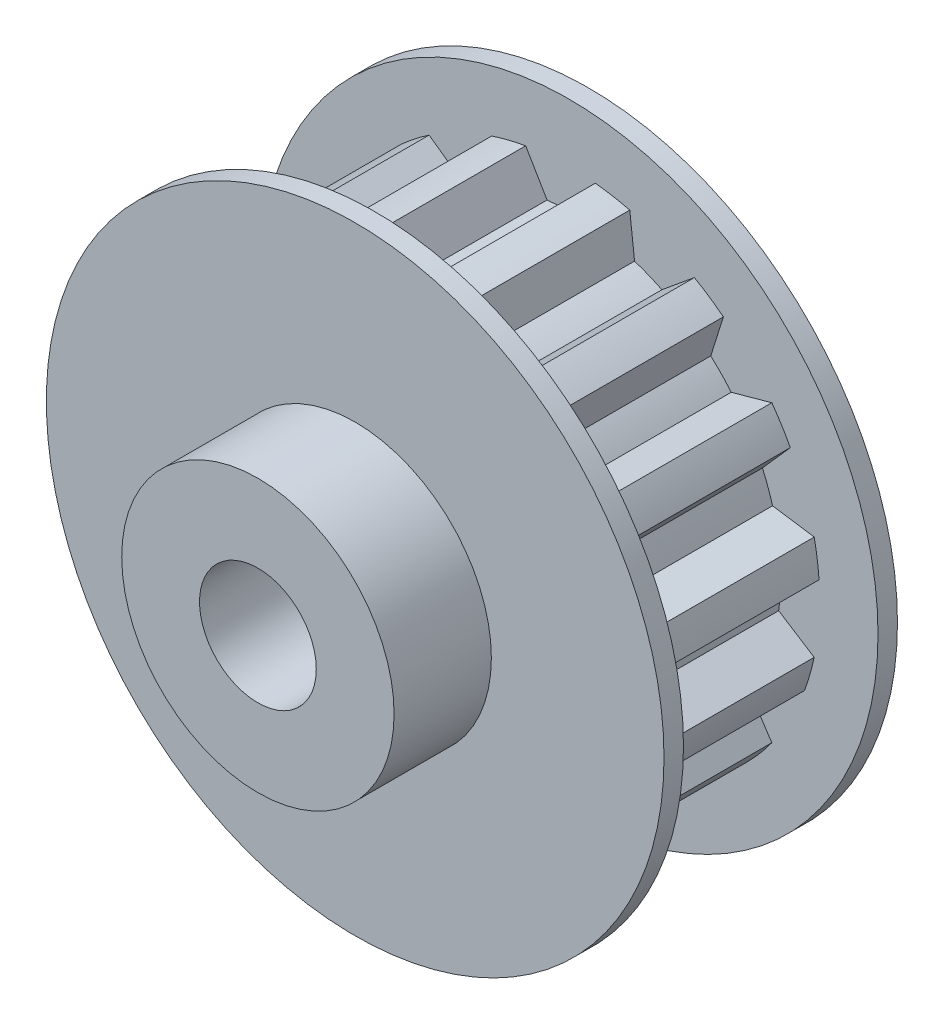
from build123d import *

# Parameters (mm, degrees)
SKETCH1_R           = 15.875
BOSS_EXTRUDE1_DEPTH = 1
BOSS_EXTRUDE2_DEPTH = 10
SKETCH3_R           = 15.875
BOSS_EXTRUDE3_DEPTH = 1
SKETCH4_R           = 7
BOSS_EXTRUDE4_DEPTH = 5
CUT_EXTRUDE1_REACH  = 30.161
SKETCH5_R           = 3


with BuildPart() as part:
    # Sketch1 → Boss-Extrude1 (new body)
    with BuildSketch(Plane.XY):
        Circle(SKETCH1_R)
    extrude(amount=BOSS_EXTRUDE1_DEPTH)

    # Sketch2 → Boss-Extrude2 (add)
    with BuildSketch(Plane.XY.offset(1)):
        with BuildLine():
            Line((9.934806852, -4.423260993), (12.098542493, -4.403509345))
            ThreePointArc((12.098542493, -4.403509345), (12.376244335, -3.548830956), (12.593650359, -2.676863019))
            Line((12.593650359, -2.676863019), (10.769165248, -1.513507473))
            ThreePointArc((10.769165248, -1.513507473), (10.848509047, -0.758601652), (10.875, 0))
            Line((10.875, 0), (12.843637147, 0.898114599))
            ThreePointArc((12.843637147, 0.898114599), (12.749701385, 1.791853675), (12.593650359, 2.676863019))
            Line((12.593650359, 2.676863019), (10.453720943, 2.997556245))
            ThreePointArc((10.453720943, 2.997556245), (10.219157251, 3.719469059), (9.934806852, 4.423260993))
            Line((9.934806852, 4.423260993), (11.367950258, 6.044446371))
            ThreePointArc((11.367950258, 6.044446371), (10.918619238, 6.822710527), (10.416093803, 7.567735123))
            Line((10.416093803, 7.567735123), (8.330733319, 6.990315255))
            ThreePointArc((8.330733319, 6.990315255), (7.822820329, 7.554409779), (7.276795344, 8.081699977))
            Line((7.276795344, 8.081699977), (7.926641495, 10.145638453))
            ThreePointArc((7.926641495, 10.145638453), (7.199608632, 10.673858747), (6.4375, 11.150077074))
            Line((6.4375, 11.150077074), (4.767286221, 9.774385254))
            ThreePointArc((4.767286221, 9.774385254), (4.073846703, 10.083124418), (3.360559814, 10.342739615))
            Line((3.360559814, 10.342739615), (3.114744406, 12.492557476))
            ThreePointArc((3.114744406, 12.492557476), (2.235720287, 12.67939982), (1.345803965, 12.804469403))
            Line((1.345803965, 12.804469403), (0.379532027, 10.868375244))
            ThreePointArc((0.379532027, 10.868375244), (-0.379532027, 10.868375244), (-1.136747038, 10.815425612))
            Line((-1.136747038, 10.815425612), (-2.235720287, 12.67939982))
            ThreePointArc((-2.235720287, 12.67939982), (-3.114744406, 12.492557476), (-3.978593803, 12.244852647))
            Line((-3.978593803, 12.244852647), (-4.073846703, 10.083124418))
            ThreePointArc((-4.073846703, 10.083124418), (-4.767286221, 9.774385254), (-5.4375, 9.418026266))
            Line((-5.4375, 9.418026266), (-7.199608632, 10.673858747))
            ThreePointArc((-7.199608632, 10.673858747), (-7.926641495, 10.145638453), (-8.615056557, 9.567989628))
            Line((-8.615056557, 9.567989628), (-7.822820329, 7.554409779))
            ThreePointArc((-7.822820329, 7.554409779), (-8.330733319, 6.990315255), (-8.798059814, 6.392164619))
            Line((-8.798059814, 6.392164619), (-10.918619238, 6.822710527))
            ThreePointArc((-10.918619238, 6.822710527), (-11.367950258, 6.044446371), (-11.761897767, 5.23673428))
            Line((-11.761897767, 5.23673428), (-10.219157251, 3.719469059))
            ThreePointArc((-10.219157251, 3.719469059), (-10.453720943, 2.997556245), (-10.637355158, 2.261039638))
            Line((-10.637355158, 2.261039638), (-12.749701385, 1.791853675))
            ThreePointArc((-12.749701385, 1.791853675), (-12.843637147, 0.898114599), (-12.875, 0))
            Line((-12.875, 0), (-10.848509047, -0.758601652))
            ThreePointArc((-10.848509047, -0.758601652), (-10.769165248, -1.513507473), (-10.637355158, -2.261039638))
            Line((-10.637355158, -2.261039638), (-12.376244335, -3.548830956))
            ThreePointArc((-12.376244335, -3.548830956), (-12.098542493, -4.403509345), (-11.761897767, -5.23673428))
            Line((-11.761897767, -5.23673428), (-9.602055072, -5.105503245))
            ThreePointArc((-9.602055072, -5.105503245), (-9.222523046, -5.762871999), (-8.798059814, -6.392164619))
            Line((-8.798059814, -6.392164619), (-9.862822205, -8.275890475))
            ThreePointArc((-9.862822205, -8.275890475), (-9.261499929, -8.94372652), (-8.615056557, -9.567989628))
            Line((-8.615056557, -9.567989628), (-6.695318544, -8.569616945))
            ThreePointArc((-6.695318544, -8.569616945), (-6.081222825, -9.015783602), (-5.4375, -9.418026266))
            Line((-5.4375, -9.418026266), (-5.644028515, -11.571973346))
            ThreePointArc((-5.644028515, -11.571973346), (-4.82305989, -11.937492128), (-3.978593803, -12.244852647))
            Line((-3.978593803, -12.244852647), (-2.630900615, -10.551966023))
            ThreePointArc((-2.630900615, -10.551966023), (-1.888423932, -10.709784314), (-1.136747038, -10.815425612))
            Line((-1.136747038, -10.815425612), (-0.44933102, -12.867156898))
            ThreePointArc((-0.44933102, -12.867156898), (0.44933102, -12.867156898), (1.345803965, -12.804469403))
            Line((1.345803965, -12.804469403), (1.888423932, -10.709784314))
            ThreePointArc((1.888423932, -10.709784314), (2.630900615, -10.551966023), (3.360559814, -10.342739615))
            Line((3.360559814, -10.342739615), (4.82305989, -11.937492128))
            ThreePointArc((4.82305989, -11.937492128), (5.644028515, -11.571973346), (6.4375, -11.150077074))
            Line((6.4375, -11.150077074), (6.081222825, -9.015783602))
            ThreePointArc((6.081222825, -9.015783602), (6.695318544, -8.569616945), (7.276795344, -8.081699977))
            Line((7.276795344, -8.081699977), (9.261499929, -8.94372652))
            ThreePointArc((9.261499929, -8.94372652), (9.862822205, -8.275890475), (10.416093803, -7.567735123))
            Line((10.416093803, -7.567735123), (9.222523046, -5.762871999))
            ThreePointArc((9.222523046, -5.762871999), (9.602055072, -5.105503245), (9.934806852, -4.423260993))
        make_face()
    extrude(amount=BOSS_EXTRUDE2_DEPTH)

    # Sketch3 → Boss-Extrude3 (add)
    with BuildSketch(Plane.XY.offset(11)):
        Circle(SKETCH3_R)
    extrude(amount=BOSS_EXTRUDE3_DEPTH)

    # Sketch4 → Boss-Extrude4 (add)
    with BuildSketch(Plane.XY.offset(12)):
        Circle(SKETCH4_R)
    extrude(amount=BOSS_EXTRUDE4_DEPTH)

    # Sketch5 → Cut-Extrude1 (cut, up to next)
    with BuildSketch(Plane.XY.offset(17), mode=Mode.PRIVATE) as cut_extrude1_sk1:
        Circle(SKETCH5_R)
    cut_extrude1_tool1 = extrude(cut_extrude1_sk1.sketch, amount=-CUT_EXTRUDE1_REACH, mode=Mode.PRIVATE) & part.part
    add(cut_extrude1_tool1.solids().sort_by_distance((0, 0, 17))[0], mode=Mode.SUBTRACT)


solid = part.part
